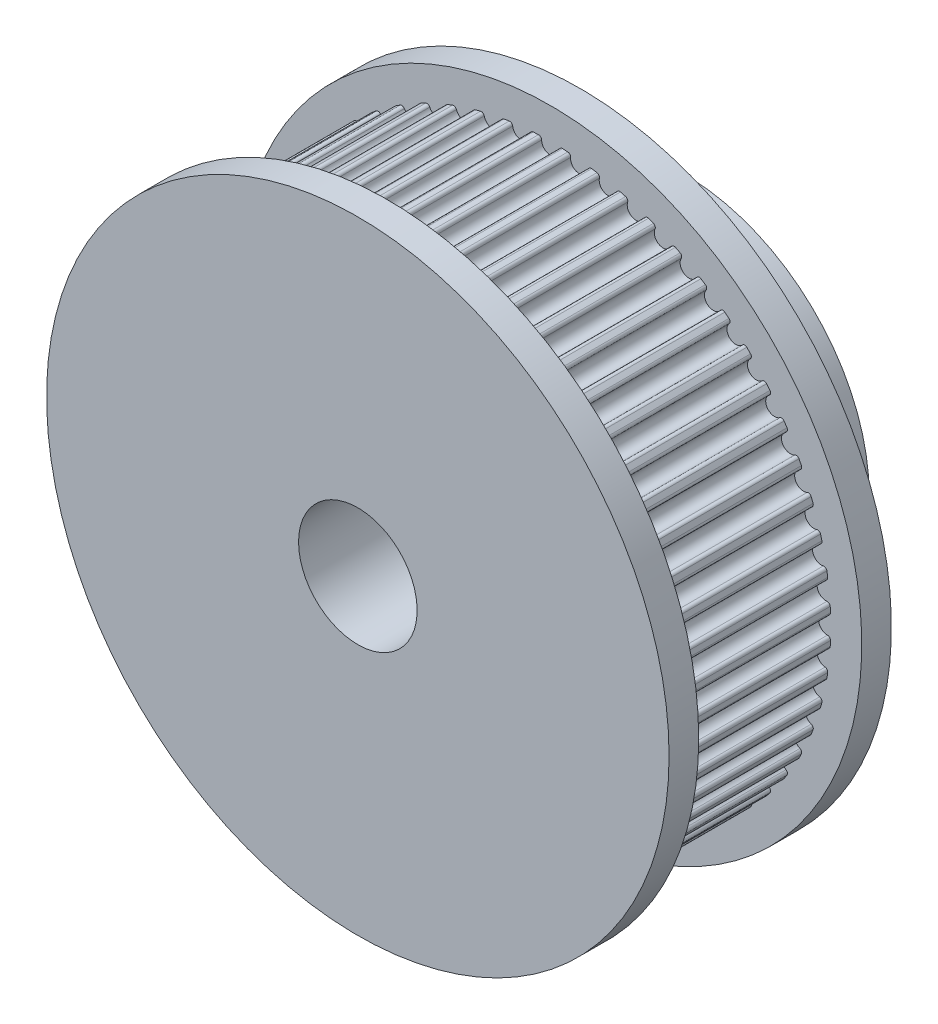
from build123d import *

# Parameters (mm, degrees)
SKETCHREVOLVEGEARBELT02_W       = 11
SKETCHREVOLVEGEARBELT02_H       = 18.908092887
TOOTHEXTRUDECUTGEARBELT02_DEPTH = 5.6
PATTERNGEARBELT02_COUNT         = 60
SKETCH5_R                       = 21
BOSS_EXTRUDE1_DEPTH             = 2
BOSS_EXTRUDE2_START             = 2
SKETCH6_R                       = 21
BOSS_EXTRUDE2_DEPTH             = 2
SKETCH7_R                       = 12.5
BOSS_EXTRUDE3_DEPTH             = 7
SKETCH8_R                       = 4
CUT_EXTRUDE2_DEPTH              = 37.959437225


with BuildPart() as part:
    # SketchRevolveGearBelt02 → GearBelt02 (revolve)
    with BuildSketch(Plane(origin=(0, 0, 0), x_dir=(0, 0, -1), z_dir=(1, 0, 0))):
        with Locations((0, 9.454046444)):
            Rectangle(SKETCHREVOLVEGEARBELT02_W, SKETCHREVOLVEGEARBELT02_H)
    revolve(axis=Axis((0, 0, 0), (0, 0, -1)))

    # SketchToothGearBelt02 → ToothExtrudeCutGearBelt02 (cut, symmetric)
    with BuildSketch(Plane.XY):
        with BuildLine():
            Line((-0.810458232, 18.890715552), (0, 21.448092849))
            Line((0, 21.448092849), (0.810458232, 18.890715552))
            ThreePointArc((0.810458232, 18.890715552), (0.662199993, 18.834818977), (0.599999991, 18.68909289))
            ThreePointArc((0.599999991, 18.68909289), (0, 18.089092899), (-0.599999991, 18.68909289))
            ThreePointArc((-0.599999991, 18.68909289), (-0.662199993, 18.834818977), (-0.810458232, 18.890715552))
        make_face()
    toothextrudecutgearbelt02 = extrude(amount=TOOTHEXTRUDECUTGEARBELT02_DEPTH, both=True, mode=Mode.SUBTRACT)

    # PatternGearBelt02: ToothExtrudeCutGearBelt02 ×60 about axis
    patterngearbelt02_axis = Axis((0, 0, 55), (0, 0, -1))
    for i in range(1, PATTERNGEARBELT02_COUNT):
        add(toothextrudecutgearbelt02.rotate(patterngearbelt02_axis, i * 360 / PATTERNGEARBELT02_COUNT), mode=Mode.SUBTRACT)

    # Sketch5 → Boss-Extrude1 (add)
    with BuildSketch(Plane.XY.offset(5.5)):
        Circle(SKETCH5_R)
    extrude(amount=BOSS_EXTRUDE1_DEPTH)

    # Sketch6 → Boss-Extrude2 (add)
    with BuildSketch(Plane(origin=(0, 0, -5.5), x_dir=(-1, 0, 0), z_dir=(0, 0, -1)).offset(BOSS_EXTRUDE2_START)):
        Circle(SKETCH6_R)
    extrude(amount=-BOSS_EXTRUDE2_DEPTH)

    # Sketch7 → Boss-Extrude3 (add)
    with BuildSketch(Plane(origin=(0, 0, -7.5), x_dir=(-1, 0, 0), z_dir=(0, 0, -1))):
        Circle(SKETCH7_R)
    extrude(amount=BOSS_EXTRUDE3_DEPTH)

    # Sketch8 → Cut-Extrude2 (cut, through all)
    with BuildSketch(Plane(origin=(0, 0, -14.5), x_dir=(-1, 0, 0), z_dir=(0, 0, -1))):
        Circle(SKETCH8_R)
    extrude(amount=-CUT_EXTRUDE2_DEPTH, mode=Mode.SUBTRACT)


solid = part.part
